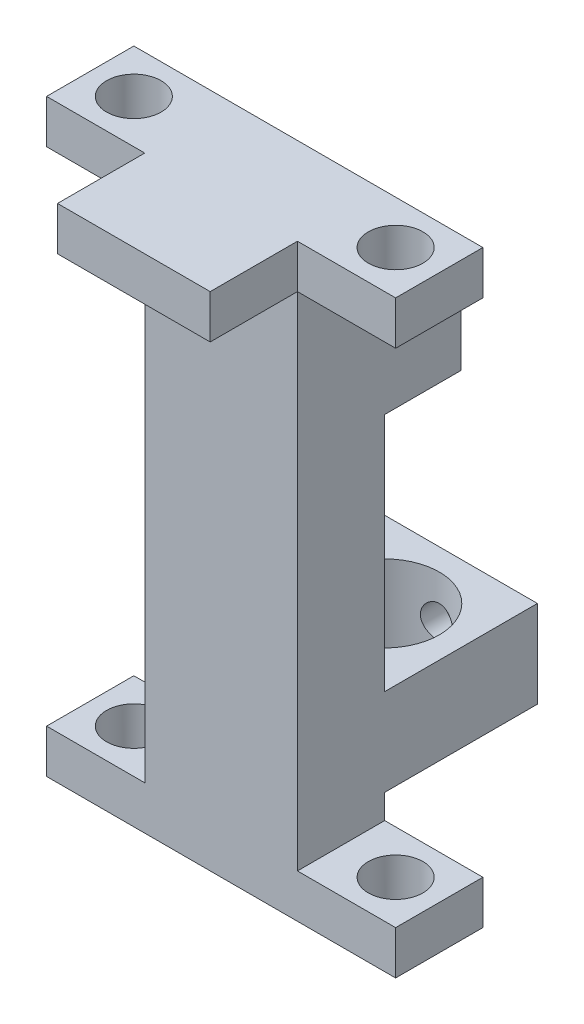
from build123d import *

# Parameters (mm, degrees)
ESQUISSE1_W             = 32
ESQUISSE1_H             = 54
BOSS_EXTRU_1_DEPTH      = 8
ESQUISSE2_W             = 32
ESQUISSE2_H             = 4
BOSS_EXTRU_2_DEPTH      = 10
ESQUISSE3_W             = 8
ESQUISSE3_H             = 46
ENL_V_MAT_EXTRU_1_DEPTH = 9
ESQUISSE4_W             = 8
ESQUISSE4_H             = 46
ENL_V_MAT_EXTRU_2_DEPTH = 9
ESQUISSE5_R             = 2.5
ENL_V_MAT_EXTRU_3_DEPTH = 54
ESQUISSE6_W             = 14
ESQUISSE6_H             = 8
BOSS_EXTRU_3_DEPTH      = 14
ESQUISSE9_W             = 9
ESQUISSE9_H             = 10
ENL_V_MAT_EXTRU_6_DEPTH = 4
ESQUISSE10_W            = 14
ESQUISSE10_H            = 6
BOSS_EXTRU_4_DEPTH      = 7
ESQUISSE7_R             = 5
ENL_V_MAT_EXTRU_4_DEPTH = 55.118693403
ESQUISSE8_R             = 1.5
ENL_V_MAT_EXTRU_5_DEPTH = 7
ENL_V_MAT_EXTRU_7_DEPTH = 6
ESQUISSE12_W            = 14
ESQUISSE12_H            = 2
ENL_V_MAT_EXTRU_8_DEPTH = 66.299310869


with BuildPart() as part:
    # Esquisse1 → Boss.-Extru.1 (new body)
    with BuildSketch(Plane.XY):
        with Locations((16, 27)):
            Rectangle(ESQUISSE1_W, ESQUISSE1_H)
    extrude(amount=BOSS_EXTRU_1_DEPTH)

    # Esquisse2 → Boss.-Extru.2 (add)
    with BuildSketch(Plane.XY.offset(8)):
        with Locations((16, 52)):
            Rectangle(ESQUISSE2_W, ESQUISSE2_H)
    extrude(amount=BOSS_EXTRU_2_DEPTH)

    # Esquisse3 → Enlèv. mat.-Extru.1 (cut)
    with BuildSketch(Plane(origin=(32, 0, 0), x_dir=(0, 0, -1), z_dir=(1, 0, 0))):
        with Locations((-4, 27)):
            Rectangle(ESQUISSE3_W, ESQUISSE3_H)
    extrude(amount=-ENL_V_MAT_EXTRU_1_DEPTH, mode=Mode.SUBTRACT)

    # Esquisse4 → Enlèv. mat.-Extru.2 (cut)
    with BuildSketch(Plane.ZY):
        with Locations((4, 27)):
            Rectangle(ESQUISSE4_W, ESQUISSE4_H)
    extrude(amount=-ENL_V_MAT_EXTRU_2_DEPTH, mode=Mode.SUBTRACT)

    # Esquisse5 → Enlèv. mat.-Extru.3 (cut)
    with BuildSketch(Plane(origin=(0, 54, 0), x_dir=(1, 0, 0), z_dir=(0, 1, 0))):
        with Locations(Location((4, -4, 0), (0, 0, 270))):
            Circle(ESQUISSE5_R)
        with Locations(Location((28, -4, 0), (0, 0, 270))):
            Circle(ESQUISSE5_R)
    extrude(amount=-ENL_V_MAT_EXTRU_3_DEPTH, mode=Mode.SUBTRACT)

    # Esquisse6 → Boss.-Extru.3 (add)
    with BuildSketch(Plane(origin=(0, 0, 0), x_dir=(-1, 0, 0), z_dir=(0, 0, -1))):
        with Locations((-16, 10.240309664)):
            Rectangle(ESQUISSE6_W, ESQUISSE6_H)
    extrude(amount=BOSS_EXTRU_3_DEPTH)

    # Esquisse9 → Enlèv. mat.-Extru.6 (cut)
    with BuildSketch(Plane(origin=(0, 54, 0), x_dir=(1, 0, 0), z_dir=(0, 1, 0))):
        with Locations((27.5, -13)):
            Rectangle(ESQUISSE9_W, ESQUISSE9_H)
        with Locations((4.5, -13)):
            Rectangle(ESQUISSE9_W, ESQUISSE9_H)
    extrude(amount=-ENL_V_MAT_EXTRU_6_DEPTH, mode=Mode.SUBTRACT)

    # Esquisse10 → Boss.-Extru.4 (add)
    with BuildSketch(Plane(origin=(0, 0, 0), x_dir=(-1, 0, 0), z_dir=(0, 0, -1))):
        with Locations((-16, 39.240309664)):
            Rectangle(ESQUISSE10_W, ESQUISSE10_H)
    extrude(amount=BOSS_EXTRU_4_DEPTH)

    # Esquisse7 → Enlèv. mat.-Extru.4 (cut, through all)
    with BuildSketch(Plane(origin=(0, 14.240309664, 0), x_dir=(1, 0, 0), z_dir=(0, 1, 0))):
        with Locations(Location((16, 7, 0), (0, 0, 270))):
            Circle(ESQUISSE7_R)
    extrude(amount=-ENL_V_MAT_EXTRU_4_DEPTH, mode=Mode.SUBTRACT)

    # Esquisse8 → Enlèv. mat.-Extru.5 (cut)
    with BuildSketch(Plane(origin=(0, 0, -14), x_dir=(-1, 0, 0), z_dir=(0, 0, -1))):
        with Locations((-16, 10.240309664)):
            Circle(ESQUISSE8_R)
    extrude(amount=-ENL_V_MAT_EXTRU_5_DEPTH, mode=Mode.SUBTRACT)

    # Esquisse11 → Enlèv. mat.-Extru.7 (cut)
    with BuildSketch(Plane(origin=(0, 42.240309664, 0), x_dir=(1, 0, 0), z_dir=(0, 1, 0))):
        Polygon((21, 7), (16, 2), (11, 7), align=None)
    extrude(amount=-ENL_V_MAT_EXTRU_7_DEPTH, mode=Mode.SUBTRACT)

    # Esquisse12 → Enlèv. mat.-Extru.8 (cut, through all)
    with BuildSketch(Plane(origin=(0, 54, 0), x_dir=(1, 0, 0), z_dir=(0, 1, 0))):
        with Locations((16, -17)):
            Rectangle(ESQUISSE12_W, ESQUISSE12_H)
    extrude(amount=-ENL_V_MAT_EXTRU_8_DEPTH, mode=Mode.SUBTRACT)


solid = part.part
